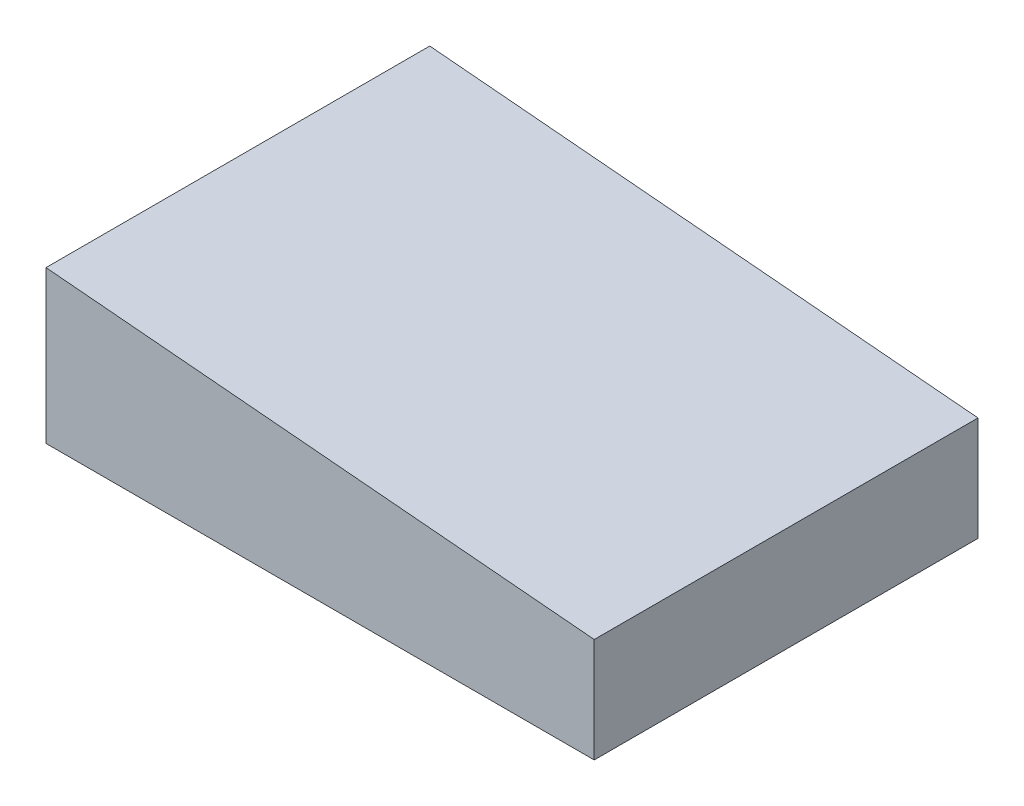
from build123d import *

# Parameters (mm, degrees)
BOSS_EXTRUDE1_DEPTH = 35
SKETCH2_W           = 217.526852971
SKETCH2_H           = 70
CUT_EXTRUDE1_DEPTH  = 70
CUT_EXTRUDE2_REACH  = 111.53
SKETCH3_R           = 1.5


with BuildPart() as part:
    # Sketch1 → Boss-Extrude1 (new, symmetric)
    with BuildSketch(Plane.XY):
        Polygon((0, 0), (0, 27.78), (317.526852971, 0), align=None)
    extrude(amount=BOSS_EXTRUDE1_DEPTH, both=True)

    # Sketch2 → Cut-Extrude1 (cut)
    with BuildSketch(Plane.XZ):
        with Locations((208.763426486, 0)):
            Rectangle(SKETCH2_W, SKETCH2_H)
    extrude(amount=-CUT_EXTRUDE1_DEPTH, mode=Mode.SUBTRACT)

    # Cut-Extrude2: up to this plane
    cut_extrude2_end = Plane(origin=(-0.261467228, 24.791415906, 35), z_dir=(-0.08715574274765117, -0.9961946980917462, 0))
    # Sketch3 → Cut-Extrude2 (cut, up to the surface)
    with BuildSketch(Plane.XZ, mode=Mode.PRIVATE) as cut_extrude2_sk1:
        with Locations((7, 28)):
            Circle(SKETCH3_R)
    cut_extrude2_tool1 = split(extrude(cut_extrude2_sk1.sketch, amount=-CUT_EXTRUDE2_REACH, mode=Mode.PRIVATE), bisect_by=cut_extrude2_end, keep=Keep.BOTH, mode=Mode.PRIVATE)
    add(cut_extrude2_tool1.solids().sort_by_distance((7, 0, 28))[0], mode=Mode.SUBTRACT)
    # Sketch3 → Cut-Extrude2 (cut, up to the surface)
    with BuildSketch(Plane.XZ, mode=Mode.PRIVATE) as cut_extrude2_sk2:
        with Locations((93, 28)):
            Circle(SKETCH3_R)
    cut_extrude2_tool2 = split(extrude(cut_extrude2_sk2.sketch, amount=-CUT_EXTRUDE2_REACH, mode=Mode.PRIVATE), bisect_by=cut_extrude2_end, keep=Keep.BOTH, mode=Mode.PRIVATE)
    add(cut_extrude2_tool2.solids().sort_by_distance((93, 0, 28))[0], mode=Mode.SUBTRACT)
    # Sketch3 → Cut-Extrude2 (cut, up to the surface)
    with BuildSketch(Plane.XZ, mode=Mode.PRIVATE) as cut_extrude2_sk3:
        with Locations((7, -28)):
            Circle(SKETCH3_R)
    cut_extrude2_tool3 = split(extrude(cut_extrude2_sk3.sketch, amount=-CUT_EXTRUDE2_REACH, mode=Mode.PRIVATE), bisect_by=cut_extrude2_end, keep=Keep.BOTH, mode=Mode.PRIVATE)
    add(cut_extrude2_tool3.solids().sort_by_distance((7, 0, -28))[0], mode=Mode.SUBTRACT)
    # Sketch3 → Cut-Extrude2 (cut, up to the surface)
    with BuildSketch(Plane.XZ, mode=Mode.PRIVATE) as cut_extrude2_sk4:
        with Locations((93, -28)):
            Circle(SKETCH3_R)
    cut_extrude2_tool4 = split(extrude(cut_extrude2_sk4.sketch, amount=-CUT_EXTRUDE2_REACH, mode=Mode.PRIVATE), bisect_by=cut_extrude2_end, keep=Keep.BOTH, mode=Mode.PRIVATE)
    add(cut_extrude2_tool4.solids().sort_by_distance((93, 0, -28))[0], mode=Mode.SUBTRACT)


solid = part.part
